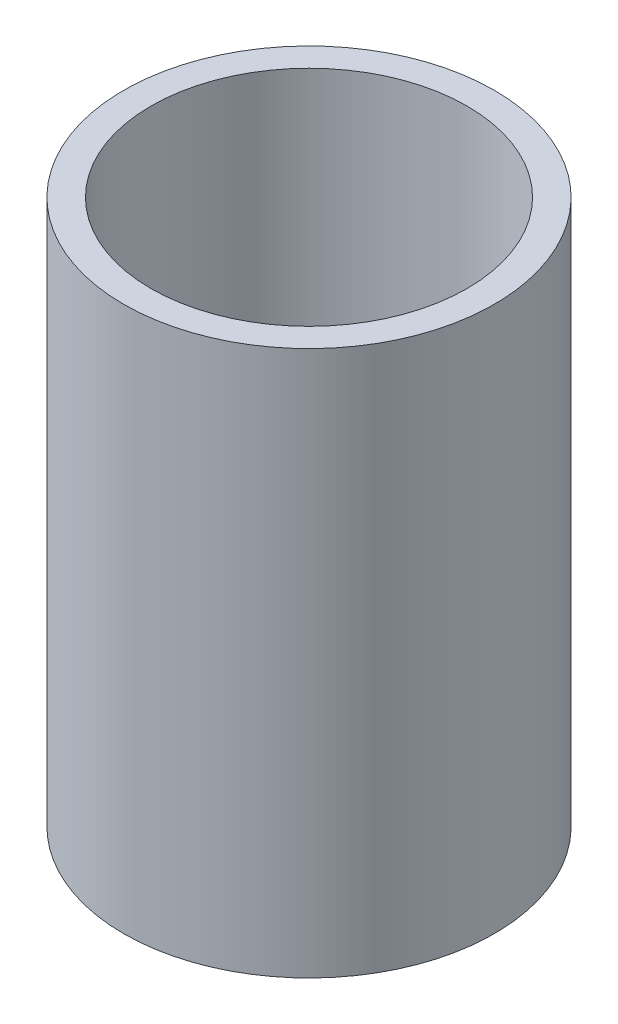
from build123d import *

# Parameters (mm, degrees)
SKETCH1_R           = 34
BOSS_EXTRUDE1_DEPTH = 100
SKETCH2_R           = 29
CUT_EXTRUDE1_DEPTH  = 100


with BuildPart() as part:
    # Sketch1 → Boss-Extrude1 (new body)
    with BuildSketch(Plane(origin=(0, 0, 0), x_dir=(1, 0, 0), z_dir=(0, 1, 0))):
        with Locations(Location((0, 0, 0), (0, 0, 270))):
            Circle(SKETCH1_R)
    extrude(amount=BOSS_EXTRUDE1_DEPTH)

    # Sketch2 → Cut-Extrude1 (cut)
    with BuildSketch(Plane(origin=(0, 100, 0), x_dir=(1, 0, 0), z_dir=(0, 1, 0))):
        with Locations(Location((0, 0, 0), (0, 0, 270))):
            Circle(SKETCH2_R)
    extrude(amount=-CUT_EXTRUDE1_DEPTH, mode=Mode.SUBTRACT)


solid = part.part
